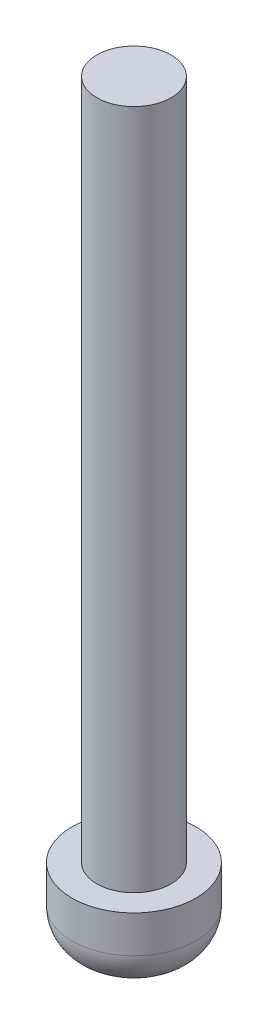
from build123d import *

# Parameters (mm, degrees)
SKETCH1_R           = 5
BOSS_EXTRUDE1_DEPTH = 6
SKETCH2_R           = 3
BOSS_EXTRUDE2_DEPTH = 55
FILLET1_R           = 3


with BuildPart() as part:
    # Sketch1 → Boss-Extrude1 (new body)
    with BuildSketch(Plane(origin=(0, 0, 0), x_dir=(1, 0, 0), z_dir=(0, 1, 0))):
        with Locations(Location((0, 0, 0), (0, 0, 270))):
            Circle(SKETCH1_R)
    extrude(amount=BOSS_EXTRUDE1_DEPTH)

    # Sketch2 → Boss-Extrude2 (add)
    with BuildSketch(Plane(origin=(0, 6, 0), x_dir=(1, 0, 0), z_dir=(0, 1, 0))):
        with Locations(Location((0, 0, 0), (0, 0, 270))):
            Circle(SKETCH2_R)
    extrude(amount=BOSS_EXTRUDE2_DEPTH)

    # Fillet1
    fillet1_edges = [part.edges().sort_by_distance(p)[0] for p in [
        (0, 0, -5),
    ]]
    fillet(fillet1_edges, radius=FILLET1_R)


solid = part.part
